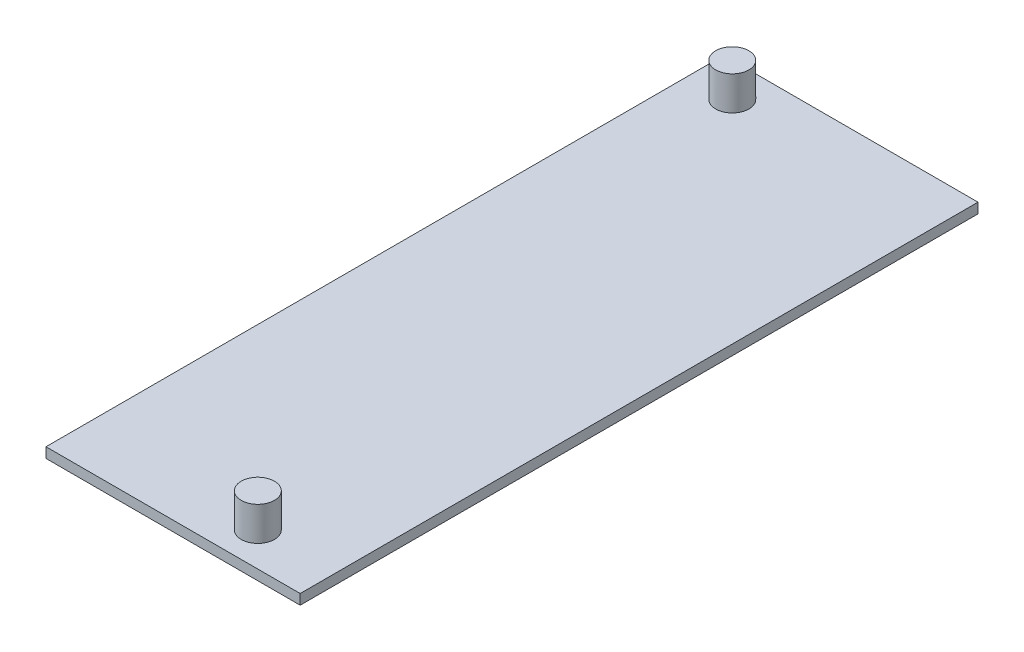
from build123d import *

# Parameters (mm, degrees)
SKETCH1_W           = 75
SKETCH1_H           = 3
BOSS_EXTRUDE1_DEPTH = 200
SKETCH2_R           = 4.9
BOSS_EXTRUDE2_DEPTH = 10
SKETCH3_W           = 5
SKETCH3_H           = 30
CUT_EXTRUDE1_DEPTH  = 1


with BuildPart() as part:
    # Sketch1 → Boss-Extrude1 (new body)
    with BuildSketch(Plane.XY):
        with Locations((37.5, 1.5)):
            Rectangle(SKETCH1_W, SKETCH1_H)
    extrude(amount=BOSS_EXTRUDE1_DEPTH)

    # Sketch2 → Boss-Extrude2 (add)
    with BuildSketch(Plane(origin=(0, 3, 0), x_dir=(1, 0, 0), z_dir=(0, 1, 0))):
        with Locations(Location((12.5, -10, 0), (0, 0, 90))):
            Circle(SKETCH2_R)
        with Locations(Location((52.5, -190, 0), (0, 0, 90))):
            Circle(SKETCH2_R)
    extrude(amount=BOSS_EXTRUDE2_DEPTH)

    # Sketch3 → Cut-Extrude1 (cut)
    with BuildSketch(Plane.XZ):
        with Locations((27.5, 165)):
            Rectangle(SKETCH3_W, SKETCH3_H)
        with Locations((27.5, 115)):
            Rectangle(SKETCH3_W, SKETCH3_H)
        with Locations((27.5, 65)):
            Rectangle(SKETCH3_W, SKETCH3_H)
        with Locations((27.5, 15)):
            Rectangle(SKETCH3_W, SKETCH3_H)
    extrude(amount=-CUT_EXTRUDE1_DEPTH, mode=Mode.SUBTRACT)


solid = part.part
